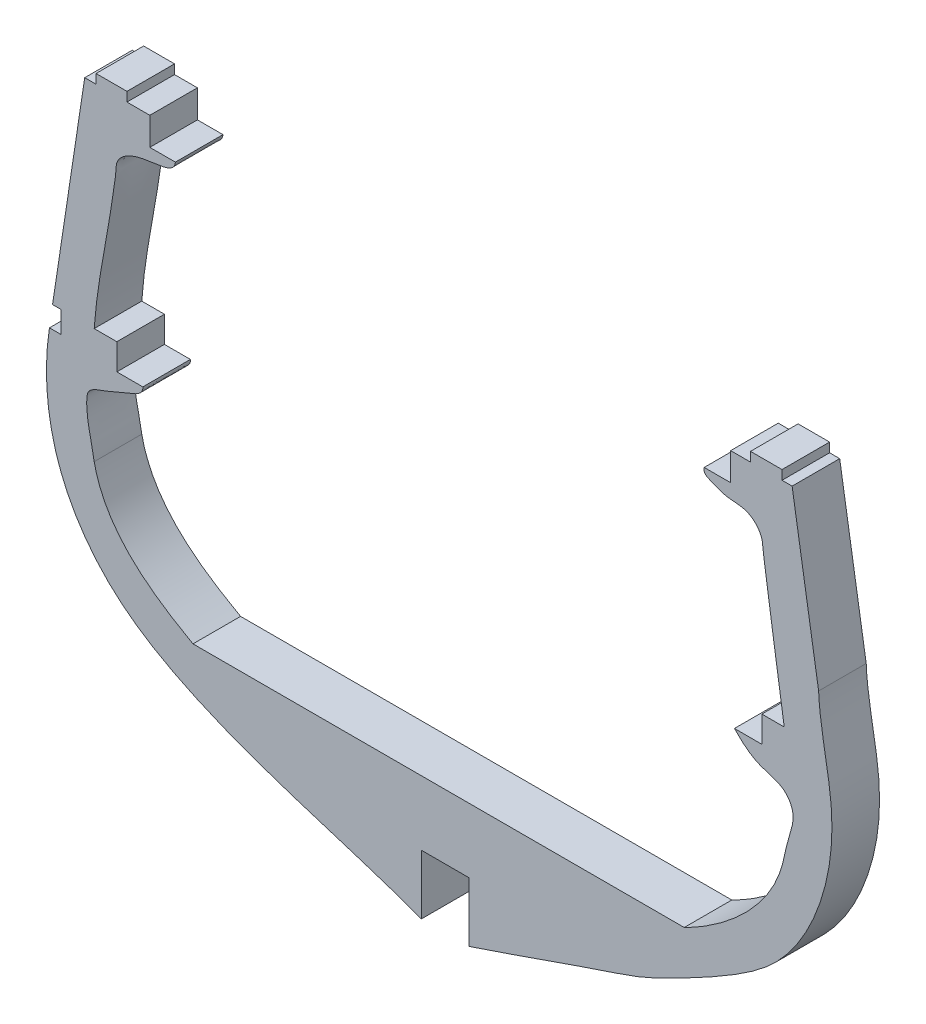
from build123d import *

# Parameters (mm, degrees)
EXTRUDE_1_DEPTH = 8


with BuildPart() as part:
    # 草图1 → 凸台-拉伸1 (new body)
    with BuildSketch(Plane.XY):
        with BuildLine():
            Line((2018.283934169, -284.348394584), (2018.283934169, -294.348394584))
            add(Edge.make_bspline(
                [(2077.047425741, -227.777971529), (2077.261245102, -233.275606695), (2079.784820426, -241.810622053), (2078.785306156, -256.87518522), (2073.005116571, -269.174981362), (2062.174356688, -276.920272976), (2045.481666076, -285.503497435), (2046.368597333, -284.501397555), (2021.251919484, -293.414758241), (2018.283934169, -294.348394584)],
                knots=[0, 0, 0, 0, 0.157381639, 0.247756685, 0.4287528, 0.514164491, 0.636986675, 0.881281265, 0.970187258, 0.970187258, 0.970187258, 0.970187258], degree=3))
            Line((2077.047425741, -227.777971529), (2072.59140661, -200.190121167))
            Line((2072.59140661, -200.190121167), (2070.896365486, -200.190121167))
            Line((2070.896365486, -200.190121167), (2070.896365486, -198.626210731))
            Line((2070.896365486, -198.626210731), (2065.599361973, -198.626210731))
            Line((2065.599361973, -198.626210731), (2065.599361973, -200.190121167))
            Line((2065.599361973, -200.190121167), (2062.262249759, -200.190121167))
            Line((2062.262249759, -200.190121167), (2062.262249759, -204.859634381))
            Line((2062.262249759, -204.859634381), (2057.812766808, -204.859634381))
            add(Edge.make_bspline(
                [(2057.812766808, -204.859634381), (2057.547410546, -205.747079978), (2059.380137336, -206.445241006), (2061.775909053, -207.45653643), (2065.217866522, -207.162019796), (2067.573603499, -209.67344298), (2067.697574883, -211.965512675), (2068.950196638, -220.45501773), (2070.107666968, -228.490375526), (2071.267155732, -235.917115463)],
                knots=[0, 0, 0, 0, 0.060523772, 0.12411076, 0.219634543, 0.316289034, 0.35532292, 0.400899314, 1, 1, 1, 1], degree=3))
            Line((2071.267155732, -235.917115463), (2067.506283237, -235.917115463))
            Line((2067.506283237, -235.917115463), (2067.506283237, -240.313628379))
            Line((2067.506283237, -240.313628379), (2062.897890181, -240.313628379))
            add(Edge.make_bspline(
                [(2054.457621521, -273.504853759), (2061.338206989, -270.102482252), (2070.027801423, -262.868321207), (2071.739320461, -251.999262564), (2073.418567387, -248.002038869), (2070.96028829, -244.304804254), (2066.602646789, -243.821548385), (2064.088374788, -241.565547662), (2062.897890181, -240.313628379)],
                knots=[0, 0, 0, 0, 0.528586857, 0.619055623, 0.732797033, 0.785421983, 0.885178905, 1, 1, 1, 1], degree=3))
            Line((2054.457621521, -273.504853759), (1971.890304964, -273.504853759))
            add(Edge.make_bspline(
                [(1971.890304964, -273.504853759), (1964.626146951, -269.478470646), (1957.119406649, -264.141004632), (1955.283025241, -255.286621508)],
                knots=[0, 0, 0, 0, 1, 1, 1, 1], degree=3))
            add(Edge.make_bspline(
                [(1963.457688057, -240.313628379), (1963.529146914, -241.121204741), (1962.239477797, -242.061479023), (1959.716193819, -242.869918509), (1957.231999476, -244.160143746), (1954.122794336, -245.033270105), (1953.851470007, -249.630690699), (1954.805230114, -252.236387239), (1955.283025241, -255.286621508)],
                knots=[0, 0, 0, 0, 0.102963072, 0.208522866, 0.386781624, 0.529425365, 0.602819093, 1, 1, 1, 1], degree=3))
            Line((1963.457688057, -240.313628379), (1959.093249435, -240.313628379))
            Line((1959.093249435, -240.313628379), (1959.093249435, -235.917115463))
            Line((1959.093249435, -235.917115463), (1955.283025241, -235.917115463))
            add(Edge.make_bspline(
                [(1968.930555536, -204.859634381), (1968.824864467, -206.04303384), (1966.962198956, -206.633697583), (1964.224545759, -206.952773023), (1961.442007709, -207.422479419), (1958.929504451, -209.228720078), (1958.985521061, -211.152355476), (1958.627059885, -213.590675778), (1957.451186426, -221.827208732), (1955.713931547, -229.599388602), (1955.283025241, -235.917115463)],
                knots=[0, 0, 0, 0, 0.07983721, 0.134651127, 0.22299695, 0.305778956, 0.343473228, 0.368850045, 0.501792392, 1, 1, 1, 1], degree=3))
            Line((1968.930555536, -204.859634381), (1964.635393717, -204.859634381))
            Line((1964.635393717, -204.859634381), (1964.635393717, -200.190121167))
            Line((1964.635393717, -200.190121167), (1960.790531121, -200.190121167))
            Line((1960.790531121, -200.190121167), (1960.790531121, -198.626210731))
            Line((1960.790531121, -198.626210731), (1955.594770857, -198.626210731))
            Line((1955.594770857, -198.626210731), (1955.594770857, -200.190121167))
            Line((1955.594770857, -200.190121167), (1953.689658759, -200.190121167))
            Line((1953.689658759, -200.190121167), (1948.286068084, -235.917115463))
            Line((1948.286068084, -235.917115463), (1949.706242556, -235.917115463))
            Line((1949.706242556, -235.917115463), (1949.706242556, -239.562448504))
            Line((1949.706242556, -239.562448504), (1947.766492058, -239.562448504))
            add(Edge.make_bspline(
                [(1947.766492058, -239.562448504), (1946.633922285, -246.756682952), (1947.816417219, -259.568350442), (1958.136739772, -273.331038229), (1978.584761323, -285.415929943), (1997.01859252, -289.400675969), (2010.282165603, -294.348394584)],
                knots=[0, 0, 0, 0, 0.237699108, 0.396499173, 0.538899202, 1, 1, 1, 1], degree=3))
            Line((2010.282165603, -294.348394584), (2010.282165603, -284.348394584))
            Line((2010.282165603, -284.348394584), (2018.283934169, -284.348394584))
        make_face()
    extrude(amount=EXTRUDE_1_DEPTH)


solid = part.part
